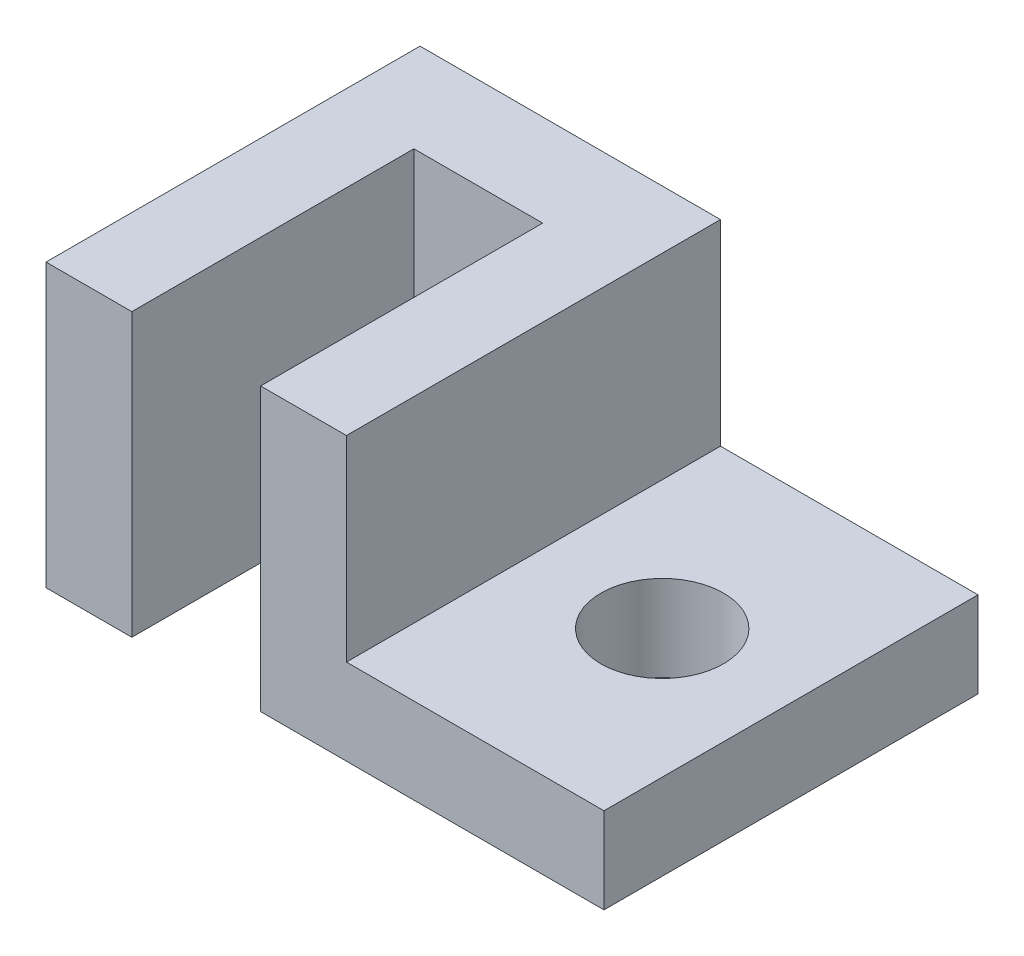
from build123d import *

# Parameters (mm, degrees)
EXTRUDE_1_DEPTH = 46
SKETCH_2_W      = 42
SKETCH_2_H      = 61
SKETCH_2_R      = 10
EXTRUDE_2_DEPTH = 14


with BuildPart() as part:
    # 스케치1 → 보스-돌출1 (new body)
    with BuildSketch(Plane(origin=(0, 0, 0), x_dir=(1, 0, 0), z_dir=(0, 1, 0))):
        Polygon((0, 0), (0, 61), (49, 61), (49, 0), (35, 0), (35, 46), (14, 46), (14, 0), align=None)
    extrude(amount=EXTRUDE_1_DEPTH)

    # 스케치2 → 보스-돌출2 (add)
    with BuildSketch(Plane(origin=(0, 0, 0), x_dir=(1, 0, 0), z_dir=(0, 1, 0))):
        with Locations((70, 30.5)):
            Rectangle(SKETCH_2_W, SKETCH_2_H)
        with Locations(Location((70, 30.5, 0), (0, 0, 270))):
            Circle(SKETCH_2_R, mode=Mode.SUBTRACT)
    extrude(amount=EXTRUDE_2_DEPTH)


solid = part.part
